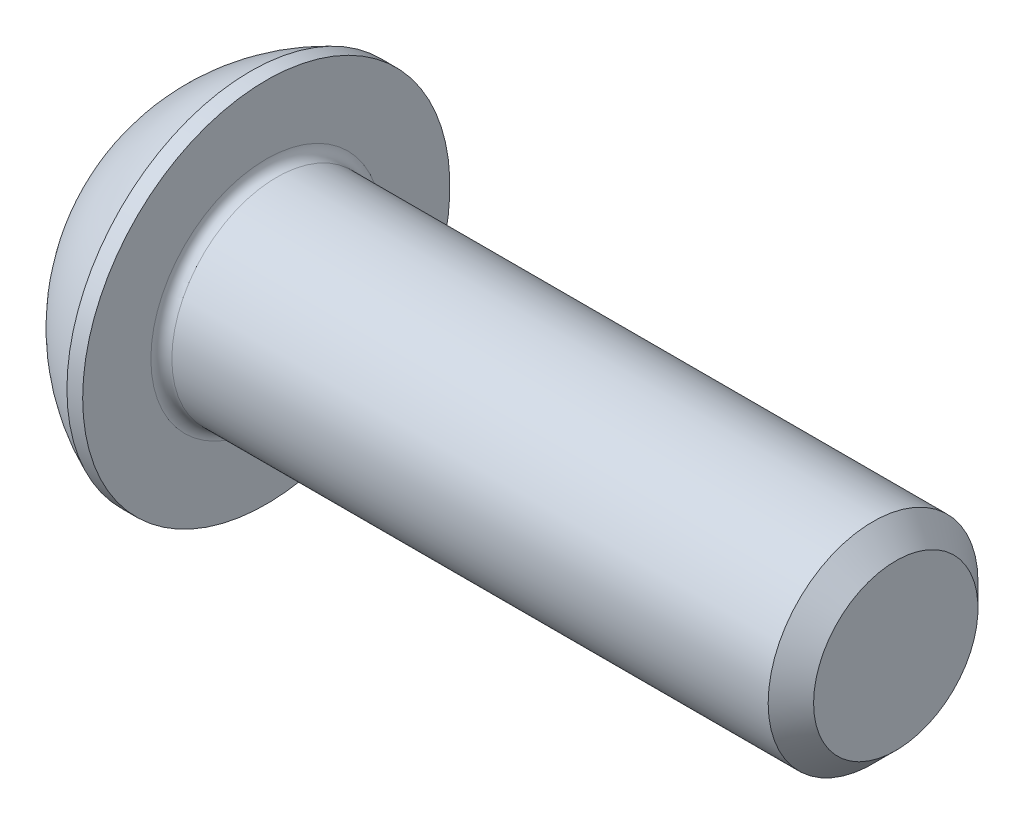
from build123d import *

# Parameters (mm, degrees)
FILLET1_R   = 0.1
HEX_2_DEPTH = 0.6


with BuildPart() as part:
    # BodySke → BaseBody (revolve)
    with BuildSketch(Plane.XY, mode=Mode.PRIVATE) as basebody_sk:
        with BuildLine():
            Line((7.1, 0), (7.1, 0.7835))
            Line((7.1, 0.7835), (6.8835, 1))
            Line((6.8835, 1), (1.1, 1))
            Line((1.1, 1), (1.1, 1.75))
            Line((1.1, 1.75), (0.95, 1.75))
            ThreePointArc((0.95, 1.75), (0.398268526, 1.395808457), (0, 0.875))
            Line((0, 0.875), (0, 0))
            Line((0, 0), (7.1, 0))
        make_face()
    revolve(basebody_sk.sketch.rotate(Axis((0, 0, 0), (1, 0, 0)), 90), axis=Axis((0, 0, 0), (1, 0, 0)))

    # Fillet1
    fillet1_edges = [part.edges().sort_by_distance(p)[0] for p in [
        (1.1, 0, -1),
    ]]
    fillet(fillet1_edges, radius=FILLET1_R)

    # Sketch2 → PreBroach (revolve, cut)
    with BuildSketch(Plane.XY, mode=Mode.PRIVATE) as prebroach_sk:
        Polygon((0, 0.715), (0.6, 0.715), (1.012805442, 0), (0, 0), align=None)
    revolve(prebroach_sk.sketch.rotate(Axis((0, 0, 0), (1, 0, 0)), 90), axis=Axis((0, 0, 0), (1, 0, 0)), mode=Mode.SUBTRACT)

    # Sketch3 → Hex 2 (cut)
    with BuildSketch(Plane(origin=(0, 0, 0), x_dir=(0, 0, -1), z_dir=(1, 0, 0))):
        Polygon((-0.65, -0.375277675), (-0.65, 0.375277675), (0, 0.75055535), (0.65, 0.375277675), (0.65, -0.375277675), (0, -0.75055535), align=None)
    extrude(amount=HEX_2_DEPTH, mode=Mode.SUBTRACT)


solid = part.part
